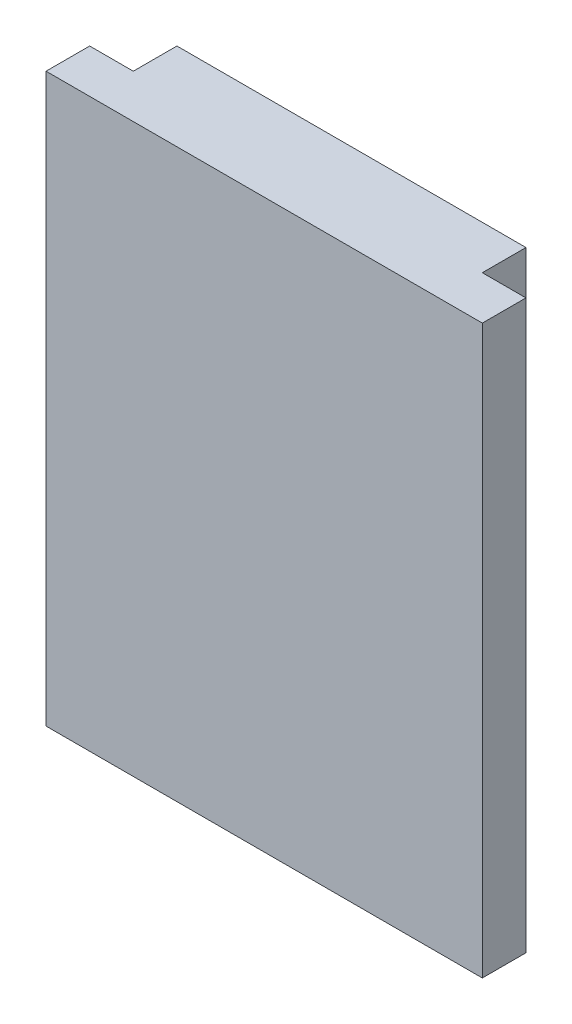
from build123d import *

# Parameters (mm, degrees)
ESQUISSE1_W        = 40
ESQUISSE1_H        = 65
BOSS_EXTRU_1_DEPTH = 5
ESQUISSE2_W        = 50
ESQUISSE2_H        = 65
BOSS_EXTRU_2_DEPTH = 5


with BuildPart() as part:
    # Esquisse1 → Boss.-Extru.1 (new body)
    with BuildSketch(Plane.XY):
        with Locations((20, 32.5)):
            Rectangle(ESQUISSE1_W, ESQUISSE1_H)
    extrude(amount=BOSS_EXTRU_1_DEPTH)

    # Esquisse2 → Boss.-Extru.2 (add)
    with BuildSketch(Plane.XY.offset(5)):
        with Locations((20, 32.5)):
            Rectangle(ESQUISSE2_W, ESQUISSE2_H)
    extrude(amount=BOSS_EXTRU_2_DEPTH)


solid = part.part
